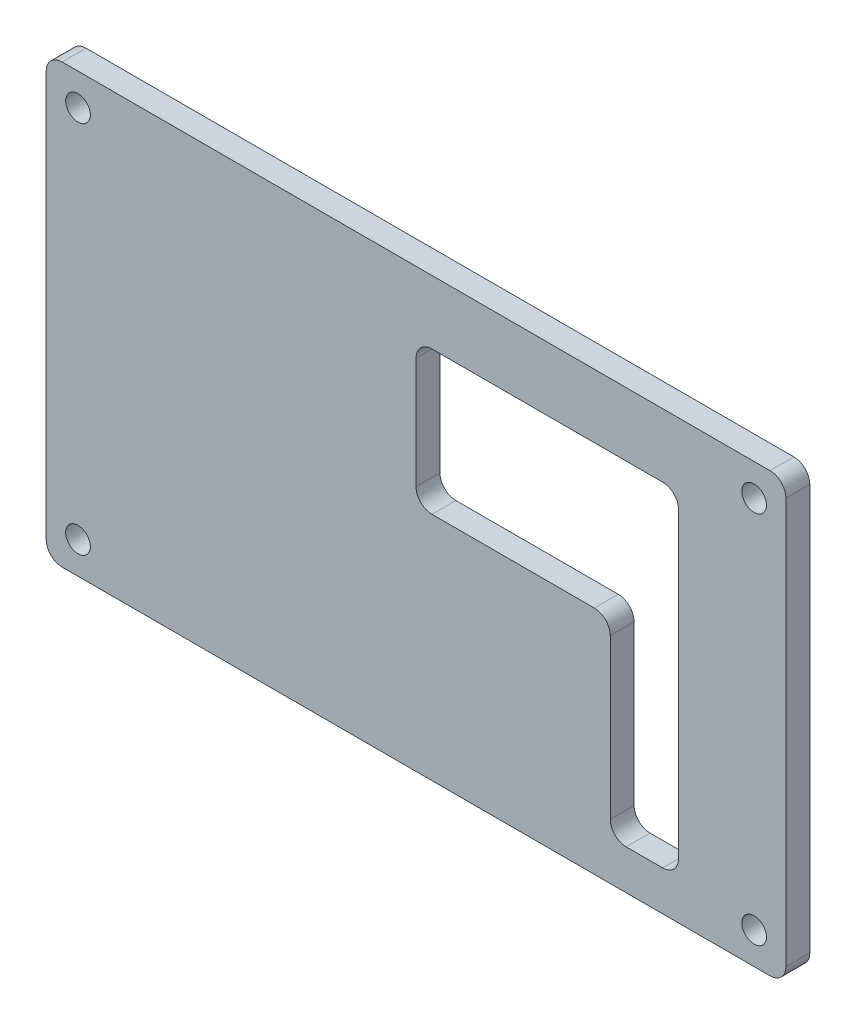
from build123d import *

# Parameters (mm, degrees)
ESQUISSE1_R        = 1.55
BOSS_EXTRU_1_DEPTH = 3


with BuildPart() as part:
    # Esquisse1 → Boss.-Extru.1 (new body)
    with BuildSketch(Plane.XY):
        with BuildLine():
            Line((-46.5, 25.5), (-46.5, -25.5))
            ThreePointArc((-46.5, -25.5), (-45.914213562, -26.914213562), (-44.5, -27.5))
            Line((-44.5, -27.5), (44.5, -27.5))
            ThreePointArc((44.5, -27.5), (45.914213562, -26.914213562), (46.5, -25.5))
            Line((46.5, -25.5), (46.5, 25.5))
            ThreePointArc((46.5, 25.5), (45.914213562, 26.914213562), (44.5, 27.5))
            Line((44.5, 27.5), (-44.5, 27.5))
            ThreePointArc((-44.5, 27.5), (-45.914213562, 26.914213562), (-46.5, 25.5))
        make_face()
        with Locations((-42.5, 23.5)):
            Circle(ESQUISSE1_R, mode=Mode.SUBTRACT)
        with Locations((-42.5, -23.5)):
            Circle(ESQUISSE1_R, mode=Mode.SUBTRACT)
        with Locations((42.5, 23.5)):
            Circle(ESQUISSE1_R, mode=Mode.SUBTRACT)
        with Locations((42.5, -23.5)):
            Circle(ESQUISSE1_R, mode=Mode.SUBTRACT)
        with BuildLine():
            Line((31, 19.5), (2, 19.5))
            ThreePointArc((2, 19.5), (0.585786438, 18.914213562), (0, 17.5))
            Line((0, 17.5), (0, 3.5))
            ThreePointArc((0, 3.5), (0.585786438, 2.085786438), (2, 1.5))
            Line((2, 1.5), (22.413214262, 1.5))
            ThreePointArc((22.413214262, 1.5), (23.827427824, 0.914213562), (24.413214262, -0.5))
            Line((24.413214262, -0.5), (24.413214262, -20.5))
            ThreePointArc((24.413214262, -20.5), (24.999000699, -21.914213562), (26.413214262, -22.5))
            Line((26.413214262, -22.5), (31, -22.5))
            ThreePointArc((31, -22.5), (32.414213562, -21.914213562), (33, -20.5))
            Line((33, -20.5), (33, 17.5))
            ThreePointArc((33, 17.5), (32.414213562, 18.914213562), (31, 19.5))
        make_face(mode=Mode.SUBTRACT)
    extrude(amount=BOSS_EXTRU_1_DEPTH)


solid = part.part
